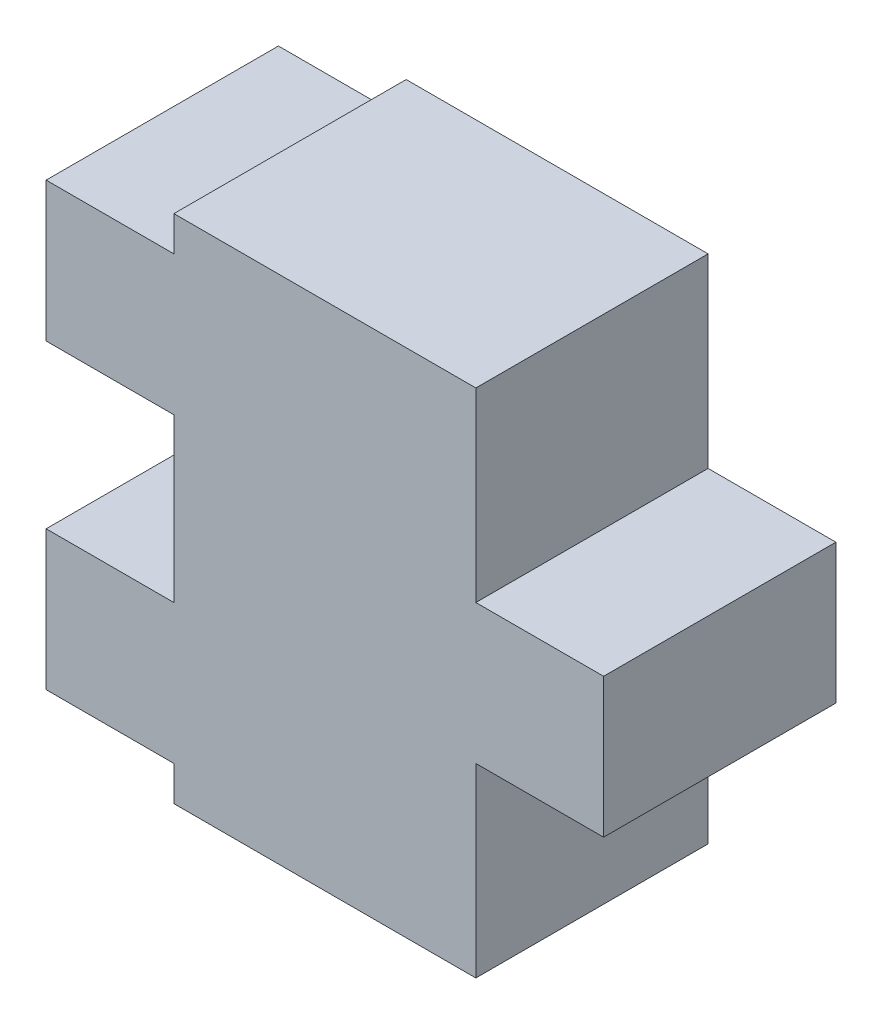
from build123d import *

# Parameters (mm, degrees)
COMPONENT_OUTLINE_DEPTH = 1


with BuildPart() as part:
    # 草图1 → Component_Outline (new body)
    with BuildSketch(Plane.XY):
        Polygon((-0.65, 1.1), (-0.65, 0.95), (-1.2, 0.95), (-1.2, 0.35), (-0.65, 0.35), (-0.65, -0.35), (-1.2, -0.35), (-1.2, -0.95), (-0.65, -0.95), (-0.65, -1.1), (0.65, -1.1), (0.65, -0.3), (1.2, -0.3), (1.2, 0.3), (0.65, 0.3), (0.65, 1.1), align=None)
    extrude(amount=COMPONENT_OUTLINE_DEPTH)


solid = part.part
